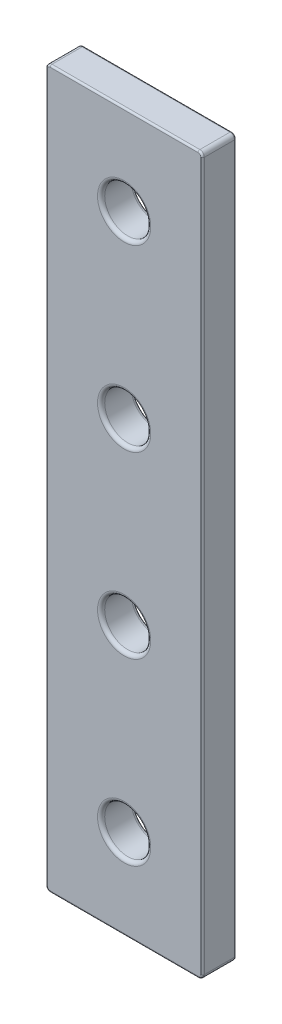
from build123d import *

# Parameters (mm, degrees)
BOSS_EXTRUDE1_START  = -2.3876
SKETCH3_W            = 22.225
SKETCH3_H            = 101.6
BOSS_EXTRUDE1_DEPTH  = 4.7752
FILLET1_R            = 0.635
SKETCH4_R            = 3.2639
CUT_EXTRUDE1_DEPTH   = 53.220017151
LPATTERN1_COUNT      = 4
LPATTERN1_PITCH      = 25.4
LPATTERN1_COUNT_DIR2 = 2
LPATTERN1_PITCH_DIR2 = 25.4
FILLET2_R            = 0.254
FILLET3_R            = 0.508


with BuildPart() as part:
    # Sketch3 → Boss-Extrude1 (new body)
    with BuildSketch(Plane.XY.offset(BOSS_EXTRUDE1_START)):
        Rectangle(SKETCH3_W, SKETCH3_H)
    extrude(amount=BOSS_EXTRUDE1_DEPTH)

    # Fillet1
    fillet1_edges = [part.edges().sort_by_distance(p)[0] for p in [
        (11.1125, 50.8, 0),
        (11.1125, -50.8, 0),
        (-11.1125, -50.8, 0),
        (-11.1125, 50.8, 0),
    ]]
    fillet(fillet1_edges, radius=FILLET1_R)

    # Sketch4 → Cut-Extrude1 (cut, through all)
    with BuildSketch(Plane.XY.offset(2.3876)):
        with Locations((0, 38.1)):
            Circle(SKETCH4_R)
    cut_extrude1 = extrude(amount=-CUT_EXTRUDE1_DEPTH, mode=Mode.SUBTRACT)

    # LPattern1: Cut-Extrude1 4 × 2
    with Locations(*[(-j * LPATTERN1_PITCH_DIR2, -i * LPATTERN1_PITCH, 0) for i in range(LPATTERN1_COUNT) for j in range(LPATTERN1_COUNT_DIR2) if (i, j) != (0, 0)]):
        add(cut_extrude1, mode=Mode.SUBTRACT)

    # Fillet2
    fillet2_edges = [part.edges().sort_by_distance(p)[0] for p in [
        (11.1125, 0, -2.3876),
        (11.1125, 0, 2.3876),
        (0, 50.8, -2.3876),
        (0, -50.8, -2.3876),
        (-11.1125, 0, -2.3876),
        (10.926512806, 50.614012806, -2.3876),
        (-10.926512806, 50.614012806, -2.3876),
        (-10.926512806, -50.614012806, -2.3876),
        (10.926512806, -50.614012806, -2.3876),
        (0, -50.8, 2.3876),
        (0, 50.8, 2.3876),
        (-11.1125, 0, 2.3876),
        (10.926512806, 50.614012806, 2.3876),
        (-10.926512806, 50.614012806, 2.3876),
        (-10.926512806, -50.614012806, 2.3876),
        (10.926512806, -50.614012806, 2.3876),
    ]]
    fillet(fillet2_edges, radius=FILLET2_R)

    # Fillet3
    fillet3_edges = [part.edges().sort_by_distance(p)[0] for p in [
        (-3.2639, 38.1, -2.3876),
        (-3.2639, 38.1, 2.3876),
        (-3.2639, 12.7, 2.3876),
        (-3.2639, 12.7, -2.3876),
        (-3.2639, -12.7, -2.3876),
        (-3.2639, -12.7, 2.3876),
        (-3.2639, -38.1, -2.3876),
        (-3.2639, -38.1, 2.3876),
    ]]
    fillet(fillet3_edges, radius=FILLET3_R)


solid = part.part
